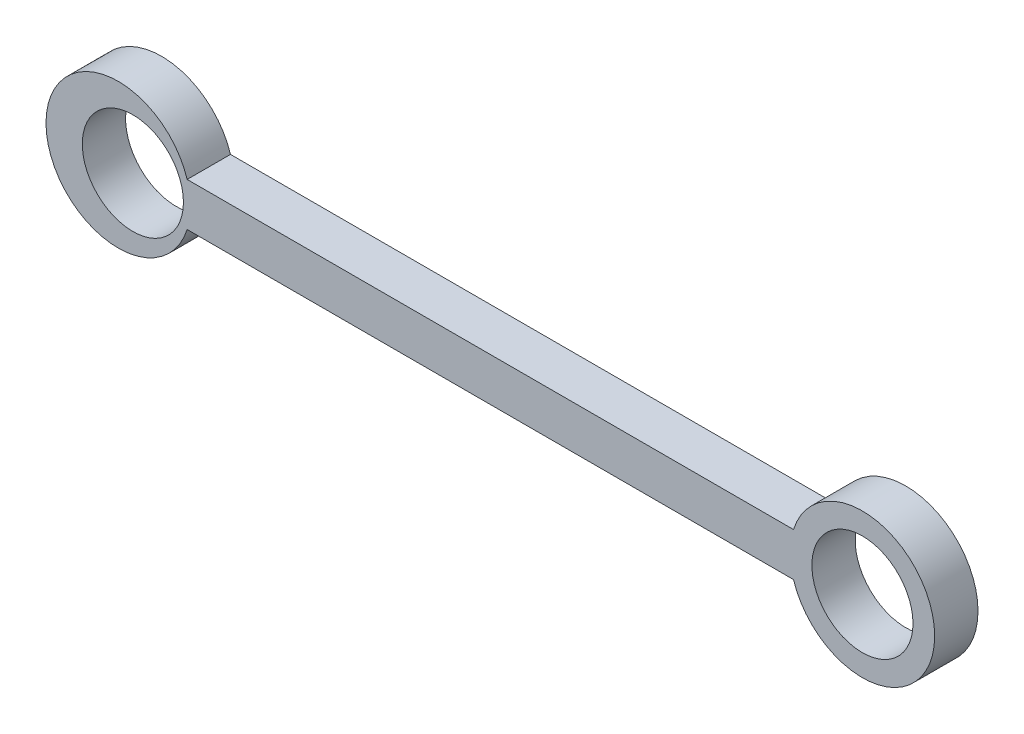
from build123d import *

# Parameters (mm, degrees)
SKETCH1_R           = 1.75
BOSS_EXTRUDE1_DEPTH = 1.5


with BuildPart() as part:
    # Sketch1 → Boss-Extrude1 (new body)
    with BuildSketch(Plane.XY):
        with BuildLine():
            Line((10.240151996, 1.5), (-10.746000706, 1.5))
            ThreePointArc((-10.746000706, 1.5), (-15.63084871, 0.75), (-10.746000706, 0))
            Line((-10.746000706, 0), (10.240151996, 0))
            ThreePointArc((10.240151996, 0), (15.125, 0.75), (10.240151996, 1.5))
        make_face()
        with Locations((-12.625, 0.75)):
            Circle(SKETCH1_R, mode=Mode.SUBTRACT)
        with Locations((12.625, 0.75)):
            Circle(SKETCH1_R, mode=Mode.SUBTRACT)
    extrude(amount=BOSS_EXTRUDE1_DEPTH)


solid = part.part
